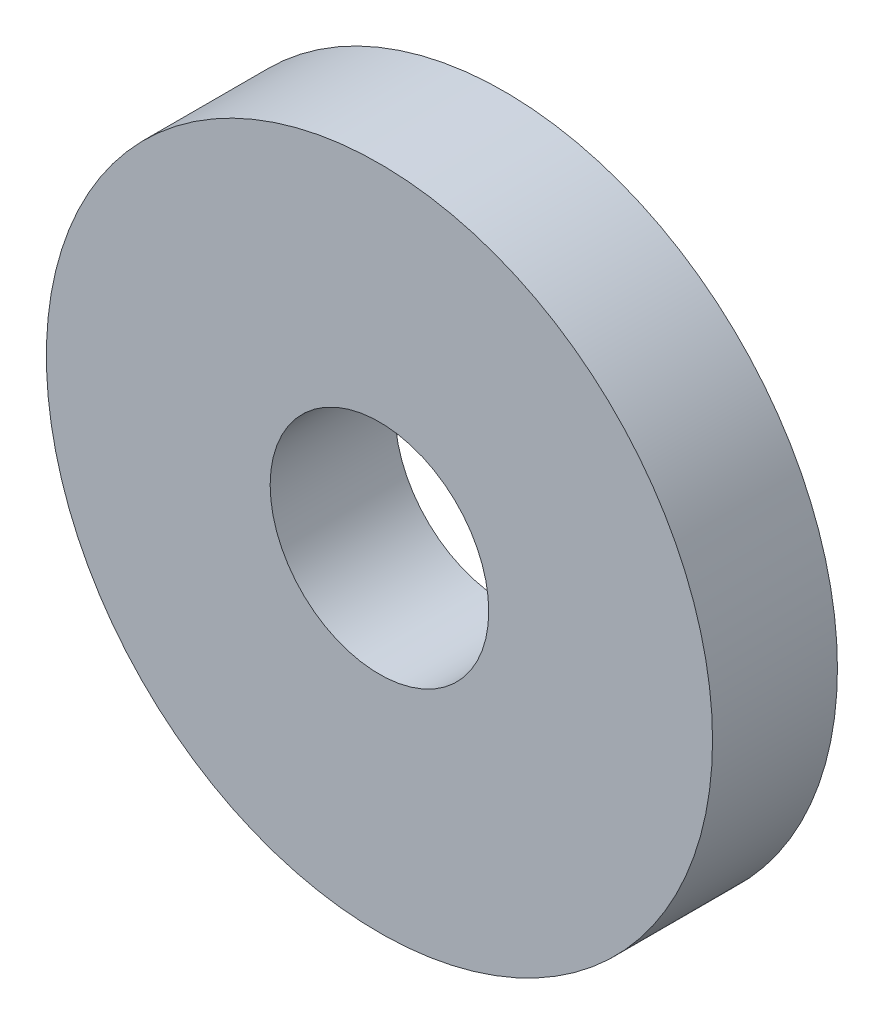
from build123d import *

# Parameters (mm, degrees)
SKETCH1_R           = 16
SKETCH1_R_2         = 5.25
BOSS_EXTRUDE1_DEPTH = 6


with BuildPart() as part:
    # Sketch1 → Boss-Extrude1 (new body)
    with BuildSketch(Plane.XY):
        Circle(SKETCH1_R)
        Circle(SKETCH1_R_2, mode=Mode.SUBTRACT)
    extrude(amount=BOSS_EXTRUDE1_DEPTH)


solid = part.part
